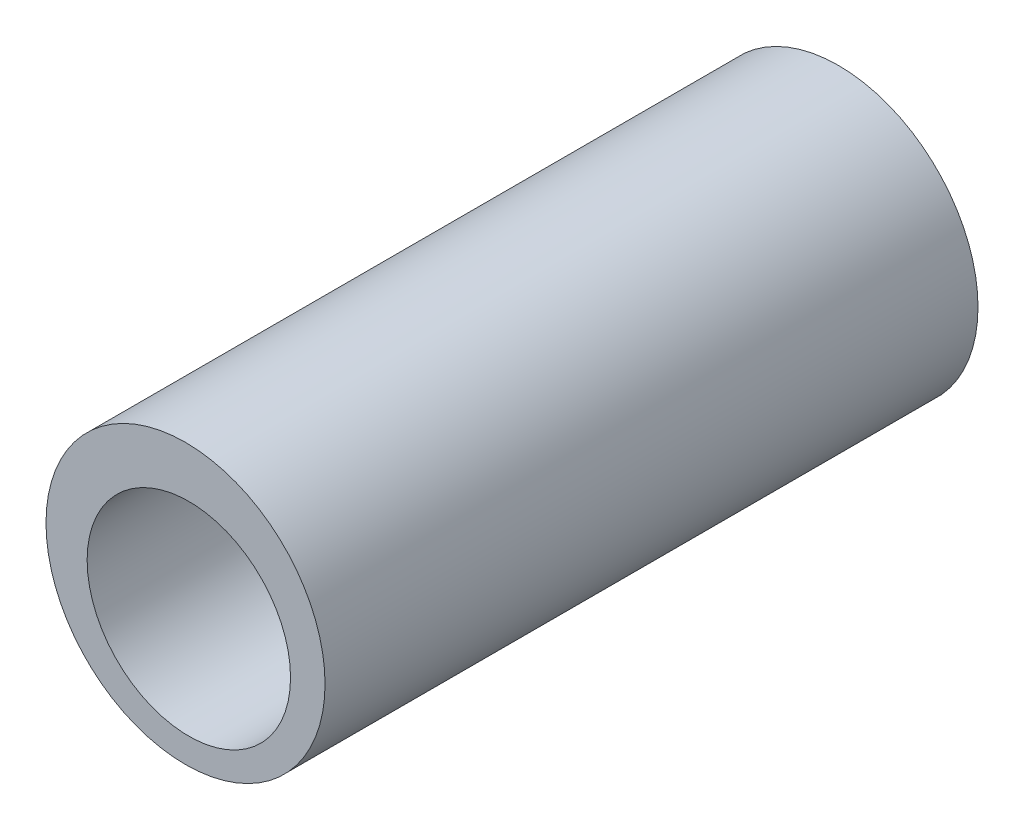
from build123d import *

# Parameters (mm, degrees)
SKETCH1_R           = 38.1
BOSS_EXTRUDE1_DEPTH = 178.308
SKETCH2_R           = 27.772240088
CUT_EXTRUDE2_DEPTH  = 178.308


with BuildPart() as part:
    # Sketch1 → Boss-Extrude1 (new body)
    with BuildSketch(Plane.XY):
        with Locations((-0.904114549, 3.164400921)):
            Circle(SKETCH1_R)
    extrude(amount=BOSS_EXTRUDE1_DEPTH)

    # Sketch2 → Cut-Extrude2 (cut)
    with BuildSketch(Plane.XY.offset(178.308)):
        Circle(SKETCH2_R)
    extrude(amount=-CUT_EXTRUDE2_DEPTH, mode=Mode.SUBTRACT)


solid = part.part
